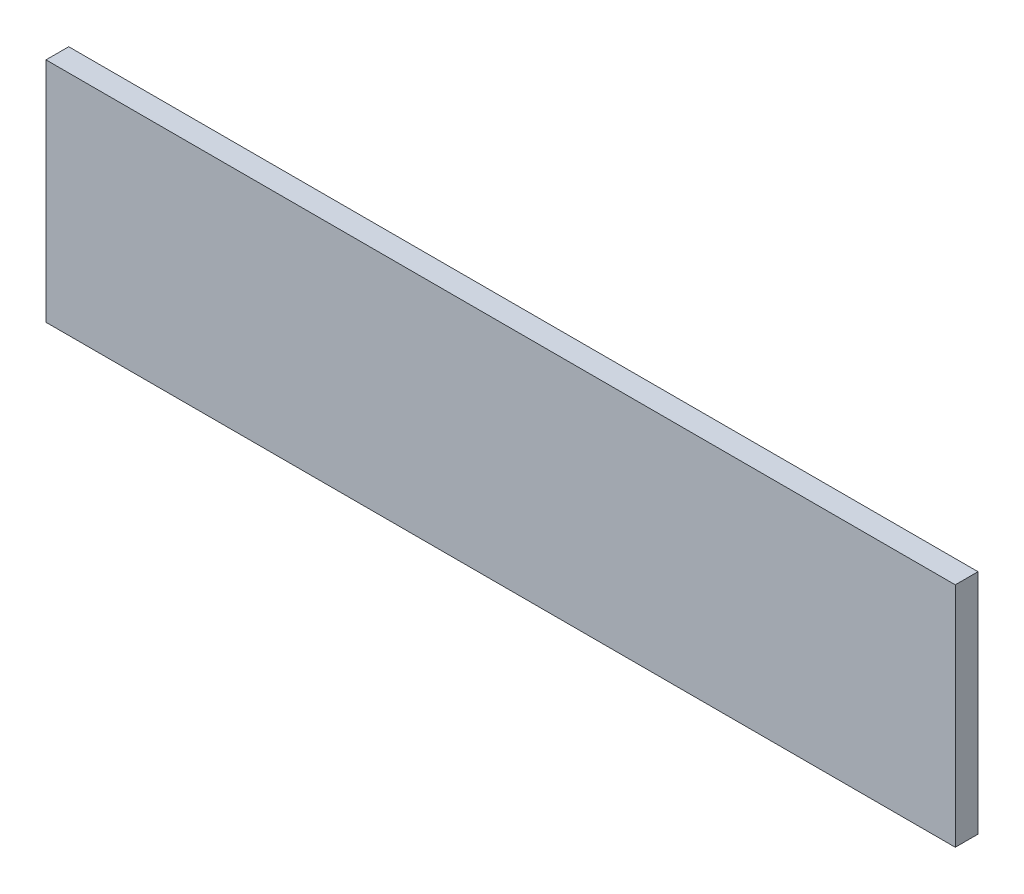
from build123d import *

# Parameters (mm, degrees)
ESQUISSE1_W        = 200
ESQUISSE1_H        = 50
BOSS_EXTRU_1_DEPTH = 5


with BuildPart() as part:
    # Esquisse1 → Boss.-Extru.1 (new body)
    with BuildSketch(Plane.XY):
        Rectangle(ESQUISSE1_W, ESQUISSE1_H)
    extrude(amount=BOSS_EXTRU_1_DEPTH)


solid = part.part
